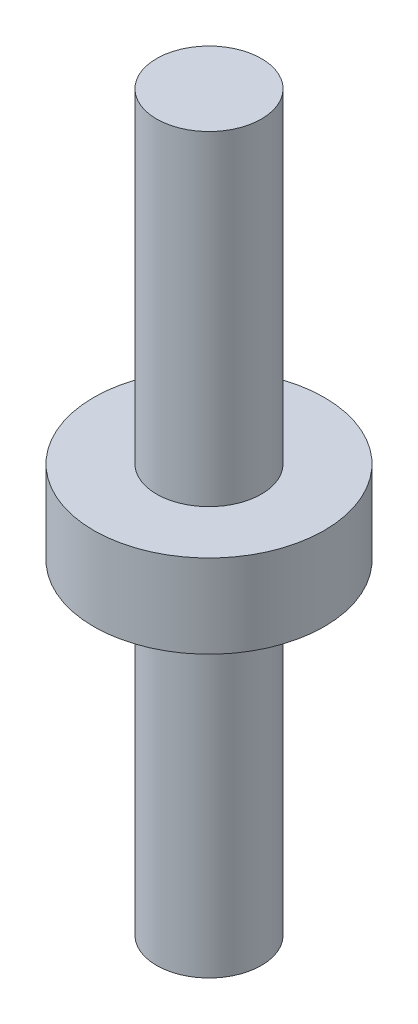
from build123d import *

# Parameters (mm, degrees)
SKETCH_1_R          = 5
EXTRUDE_1_DEPTH     = 31
SKETCH1_R           = 11
BOSS_EXTRUDE1_DEPTH = 7.95
SKETCH2_R           = 5
BOSS_EXTRUDE2_DEPTH = 31


with BuildPart() as part:
    # 草图1 → 凸台-拉伸1 (new body)
    with BuildSketch(Plane(origin=(0, 0, 0), x_dir=(1, 0, 0), z_dir=(0, 1, 0))):
        with Locations(Location((0, 0, 0), (0, 0, 270))):
            Circle(SKETCH_1_R)
    extrude(amount=EXTRUDE_1_DEPTH)

    # Sketch1 → Boss-Extrude1 (add)
    with BuildSketch(Plane(origin=(0, 31, 0), x_dir=(1, 0, 0), z_dir=(0, 1, 0))):
        with Locations(Location((0, 0, 0), (0, 0, 270))):
            Circle(SKETCH1_R)
    extrude(amount=BOSS_EXTRUDE1_DEPTH)

    # Sketch2 → Boss-Extrude2 (add)
    with BuildSketch(Plane(origin=(0, 38.95, 0), x_dir=(1, 0, 0), z_dir=(0, 1, 0))):
        with Locations(Location((0, 0, 0), (0, 0, 270))):
            Circle(SKETCH2_R)
    extrude(amount=BOSS_EXTRUDE2_DEPTH)


solid = part.part
